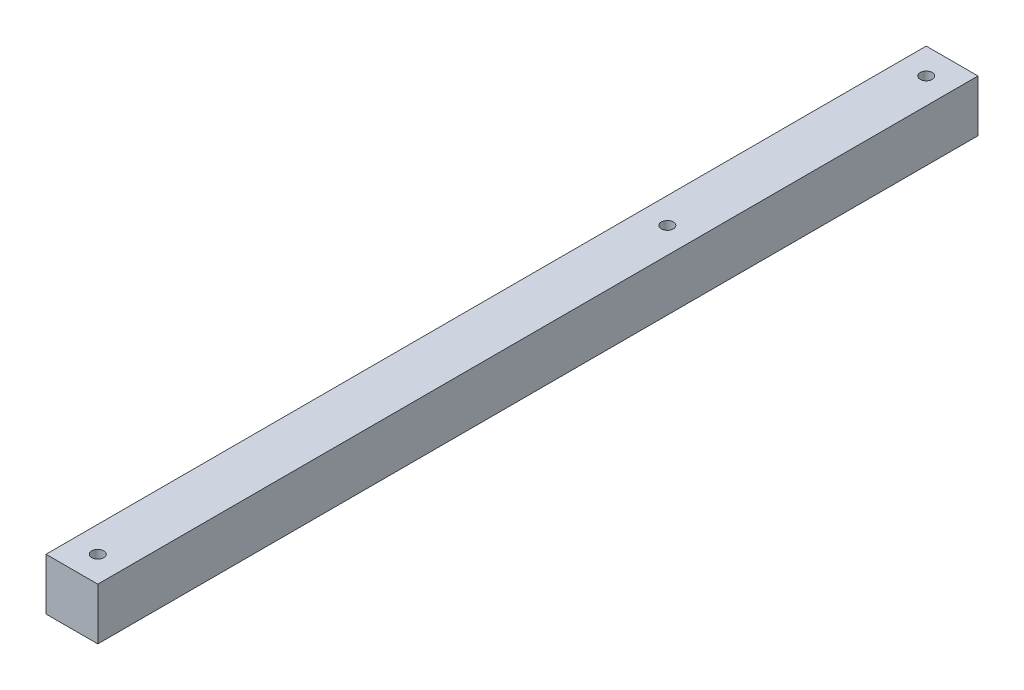
from build123d import *

# Parameters (mm, degrees)
SKETCH18_W                  = 12.7
SKETCH18_H                  = 215.9
BOSS_EXTRUDE3_DEPTH         = 12.7
F_32_0_116_DIAMETER_HOLE7_D = 2.9464


with BuildPart() as part:
    # Sketch18 → Boss-Extrude3 (new body)
    with BuildSketch(Plane(origin=(0, 0, 0), x_dir=(1, 0, 0), z_dir=(0, 1, 0))):
        with Locations((-6.35, 95.25)):
            Rectangle(SKETCH18_W, SKETCH18_H)
    extrude(amount=BOSS_EXTRUDE3_DEPTH)

    # #32 (0.116) Diameter Hole7 (through all)
    with Locations(Plane(origin=(0, 12.7, 0), x_dir=(1, 0, 0), z_dir=(0, 1, 0))):
        with Locations((-6.35, 196.85), (-6.35, 133.35), (-6.35, -6.35)):
            Hole(F_32_0_116_DIAMETER_HOLE7_D / 2)


solid = part.part
